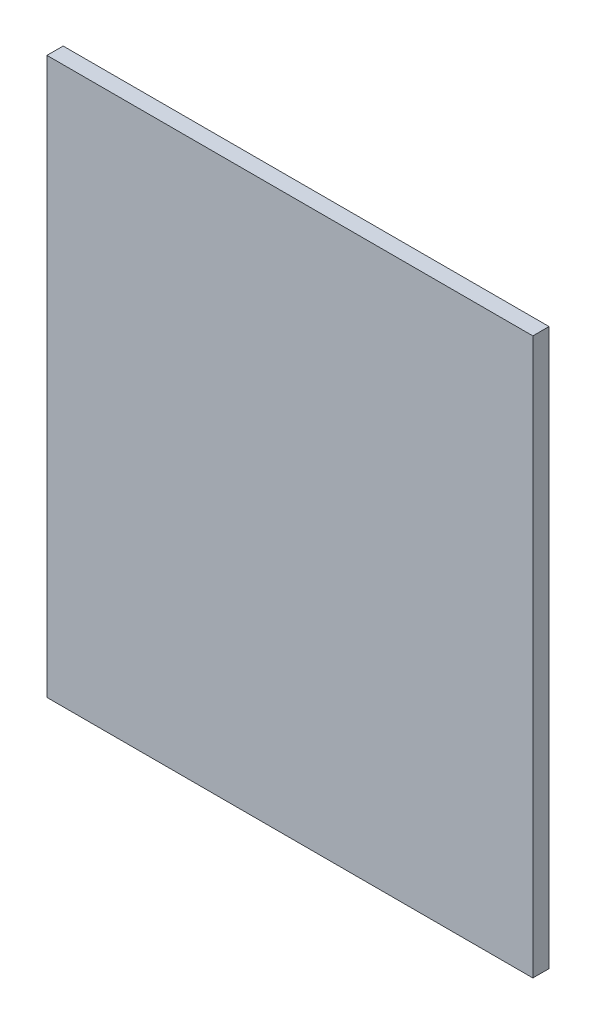
from build123d import *

# Parameters (mm, degrees)
ESQUISSE1_W        = 180
ESQUISSE1_H        = 206
BOSS_EXTRU_1_DEPTH = 6


with BuildPart() as part:
    # Esquisse1 → Boss.-Extru.1 (new body)
    with BuildSketch(Plane.XY):
        with Locations((-90, 103)):
            Rectangle(ESQUISSE1_W, ESQUISSE1_H)
    extrude(amount=BOSS_EXTRU_1_DEPTH)


solid = part.part
